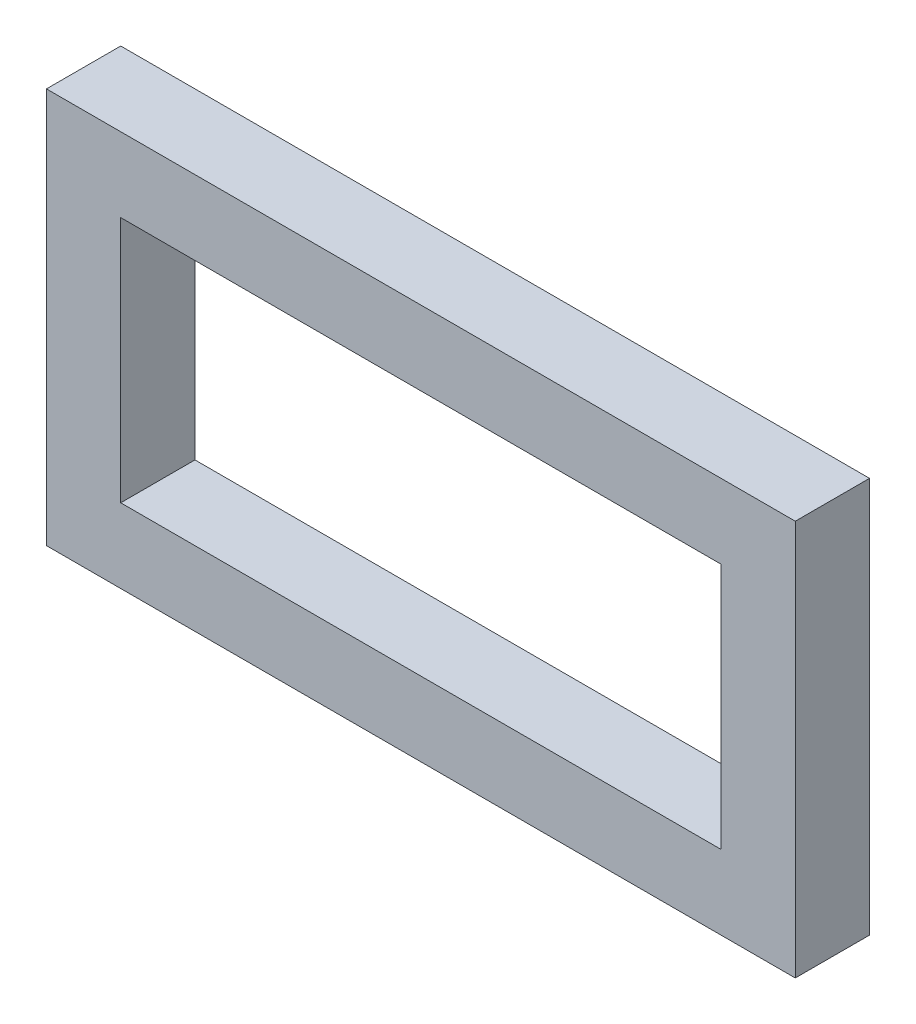
from build123d import *

# Parameters (mm, degrees)
SKETCH1_W           = 14.098000526
SKETCH1_H           = 7.448000431
SKETCH1_W_2         = 11.300000787
SKETCH1_H_2         = 4.650000215
BOSS_EXTRUDE1_DEPTH = 1.398000121


with BuildPart() as part:
    # Sketch1 → Boss-Extrude1 (new body)
    with BuildSketch(Plane.XY.offset(1.398000121)):
        with Locations((7.049000263, 3.724000216)):
            Rectangle(SKETCH1_W, SKETCH1_H)
        with Locations((7.048000515, 3.723000229)):
            Rectangle(SKETCH1_W_2, SKETCH1_H_2, mode=Mode.SUBTRACT)
    extrude(amount=-BOSS_EXTRUDE1_DEPTH)


solid = part.part
